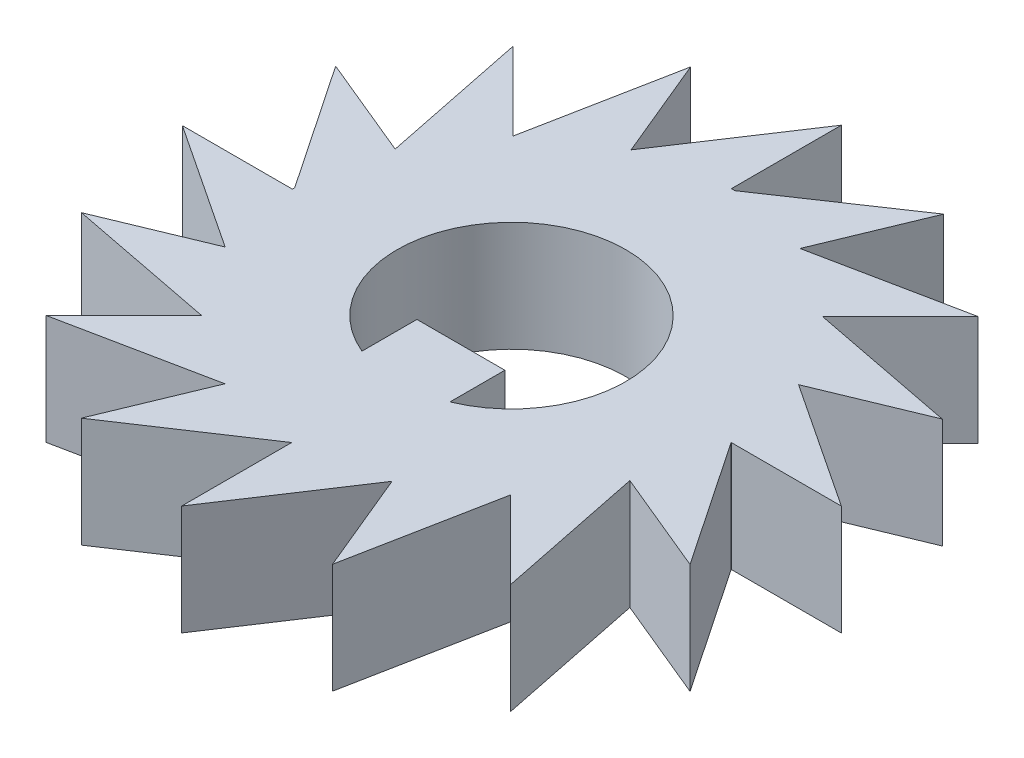
from build123d import *

# Parameters (mm, degrees)
BOSS_EXTRUDE1_DEPTH = 5


with BuildPart() as part:
    # Sketch1 → Boss-Extrude1 (new body)
    with BuildSketch(Plane(origin=(0, 0, 0), x_dir=(1, 0, 0), z_dir=(0, 1, 0))):
        with BuildLine():
            Line((0, -9.994125046), (0, -14.994125046))
            Line((0, -14.994125046), (3.808365199, -9.240312874))
            Line((3.808365199, -9.240312874), (5.72178236, -13.859710537))
            Line((5.72178236, -13.859710537), (7.038364429, -7.086482971))
            Line((7.038364429, -7.086482971), (10.573898335, -10.622016877))
            Line((10.573898335, -10.622016877), (9.186628177, -3.803366209))
            Line((9.186628177, -3.803366209), (13.858414609, -5.73848351))
            Line((13.858414609, -5.73848351), (9.999983576, -0.018124259))
            ThreePointArc((9.999983576, -0.018124259), (9.999995894, -0.009062133), (10, 0))
            Line((10, 0), (15, 0))
            Line((15, 0), (9.246512341, 3.808150408))
            Line((9.246512341, 3.808150408), (13.865910003, 5.72156757))
            Line((13.865910003, 5.72156757), (7.106491915, 7.035465347))
            Line((7.106491915, 7.035465347), (10.642025821, 10.570999253))
            Line((10.642025821, 10.570999253), (3.914062891, 9.202179725))
            Line((3.914062891, 9.202179725), (5.827480053, 13.821577387))
            Line((5.827480053, 13.821577387), (0.160205895, 9.998952701))
            ThreePointArc((0.160205895, 9.998952701), (0.080105518, 9.999915207), (0, 10.000236049))
            Line((0, 10.000236049), (0, 15.000236049))
            Line((0, 15.000236049), (-3.808365199, 9.246423877))
            Line((-3.808365199, 9.246423877), (-5.72178236, 13.86582154))
            Line((-5.72178236, 13.86582154), (-7.03571003, 7.10624967))
            Line((-7.03571003, 7.10624967), (-10.571243936, 10.641783576))
            Line((-10.571243936, 10.641783576), (-9.202378572, 3.913595357))
            Line((-9.202378572, 3.913595357), (-13.821776235, 5.827012519))
            Line((-13.821776235, 5.827012519), (-9.963345201, 0.106653268))
            ThreePointArc((-9.963345201, 0.106653268), (-9.963773316, 0.053327398), (-9.963916023, 0))
            Line((-9.963916023, 0), (-14.963916023, 0))
            Line((-14.963916023, 0), (-9.21010385, -3.808365199))
            Line((-9.21010385, -3.808365199), (-13.829501513, -5.72178236))
            Line((-13.829501513, -5.72178236), (-7.056273947, -7.038364429))
            Line((-7.056273947, -7.038364429), (-10.591807853, -10.573898335))
            Line((-10.591807853, -10.573898335), (-3.830327391, -9.198259587))
            Line((-3.830327391, -9.198259587), (-5.743744553, -13.81765725))
            Line((-5.743744553, -13.81765725), (0, -9.994125046))
        make_face()
        with BuildLine():
            Line((-2, -4.8), (-2, -2.3))
            Line((-2, -2.3), (2, -2.3))
            Line((2, -2.3), (2, -4.8))
            ThreePointArc((2, -4.8), (0, 5.2), (-2, -4.8))
        make_face(mode=Mode.SUBTRACT)
    extrude(amount=BOSS_EXTRUDE1_DEPTH)


solid = part.part
